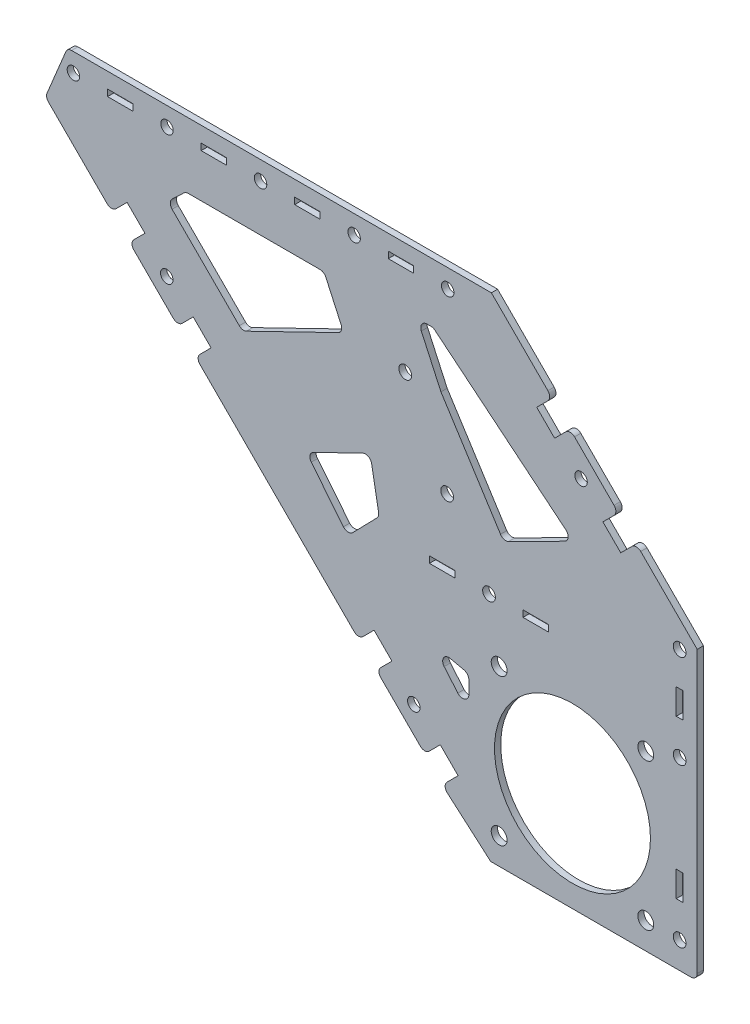
from build123d import *

# Parameters (mm, degrees)
SKETCH_1_R      = 2
SKETCH_1_R_2    = 25
SKETCH_1_R_3    = 2.05
SKETCH_1_R_4    = 2.55
SKETCH_1_W      = 8.1
SKETCH_1_H      = 2.1
SKETCH_1_W_2    = 8.2
SKETCH_1_W_3    = 2.2
SKETCH_1_H_2    = 8.2
EXTRUDE_1_DEPTH = 2
FILLET_2_R      = 2


with BuildPart() as part:
    # 草图1 → 凸台-拉伸1 (new body)
    with BuildSketch(Plane.XY):
        Polygon((7.027428163, -4.999036262), (20.810808237, -16.956988843), (73.227648339, -16.964389058), (87.027428163, -16.964389058), (87.027428163, 75.054738201), (67.497807203, 94.584359161), (63.997628636, 91.084180595), (62.512704395, 89.599256354), (56.785139468, 95.326821282), (58.270063708, 96.811745522), (61.771734574, 100.31043179), (54.027428163, 108.054738201), (46.284614051, 115.797552313), (42.784435485, 112.297373746), (41.299511244, 110.812449505), (35.571946316, 116.540014433), (37.056870557, 118.024938674), (40.557049124, 121.52511724), (21.027428163, 141.054738201), (-114.884210676, 141.054738201), (-121.955278488, 123.983670389), (-100.755816342, 102.784208243), (-97.257364322, 106.282660262), (-95.772440082, 107.767584503), (-90.044875154, 102.040019575), (-91.529799395, 100.555095335), (-95.028251414, 97.056643315), (-87.28543216, 89.313824061), (-79.542612906, 81.571004807), (-76.044160887, 85.069456827), (-74.559236646, 86.554381067), (-68.831671719, 80.82681614), (-70.316595959, 79.341891899), (-73.815047978, 75.84343988), (-21.559856849, 23.58824875), (-18.061404829, 27.086700769), (-16.576480589, 28.57162501), (-10.848915661, 22.844060082), (-12.333839902, 21.359135842), (-15.832291921, 17.860683822), (-8.089472667, 10.117864568), (-0.346653413, 2.375045314), (3.151798606, 5.873497334), (4.636722847, 7.358421574), (10.364287774, 1.630856647), (8.879363534, 0.145932406), (5.380911515, -3.352519613), align=None)
        with Locations((-52.972571837, 135.054738201)):
            Circle(SKETCH_1_R, mode=Mode.SUBTRACT)
        with Locations((47.027428163, 15.054738201)):
            Circle(SKETCH_1_R_2, mode=Mode.SUBTRACT)
        with Locations(Location((-22.972571837, 135.054738201, 0), (0, 0, 180))):
            Circle(SKETCH_1_R, mode=Mode.SUBTRACT)
        with Locations((7.027428163, 135.054738201)):
            Circle(SKETCH_1_R, mode=Mode.SUBTRACT)
        with Locations(Location((-112.972571837, 135.054738201, 0), (0, 0, 180))):
            Circle(SKETCH_1_R, mode=Mode.SUBTRACT)
        with Locations((-82.972571837, 135.054738201)):
            Circle(SKETCH_1_R, mode=Mode.SUBTRACT)
        with Locations((49.784787476, 103.812097514)):
            Circle(SKETCH_1_R, mode=Mode.SUBTRACT)
        with Locations((-83.04451802, 93.554738201)):
            Circle(SKETCH_1_R, mode=Mode.SUBTRACT)
        with Locations((20.275835807, 57.054738201)):
            Circle(SKETCH_1_R_3, mode=Mode.SUBTRACT)
        with Locations((70.527428163, -8.445261799)):
            Circle(SKETCH_1_R_4, mode=Mode.SUBTRACT)
        with Locations((23.527428163, -8.445261799)):
            Circle(SKETCH_1_R_4, mode=Mode.SUBTRACT)
        with Locations((23.527428163, 38.554738201)):
            Circle(SKETCH_1_R_4, mode=Mode.SUBTRACT)
        with Locations((70.527428163, 38.554738201)):
            Circle(SKETCH_1_R_4, mode=Mode.SUBTRACT)
        with Locations((81.392055944, 72.204829046)):
            Circle(SKETCH_1_R_3, mode=Mode.SUBTRACT)
        with Locations((81.392055944, -8.445261799)):
            Circle(SKETCH_1_R_3, mode=Mode.SUBTRACT)
        with Locations((81.392055944, 42.204829046)):
            Circle(SKETCH_1_R_3, mode=Mode.SUBTRACT)
        with Locations((6.845259268, 78.140743367)):
            Circle(SKETCH_1_R_3, mode=Mode.SUBTRACT)
        with Locations(Location((-3.848558527, 14.358778708, 0), (0, 0, 180))):
            Circle(SKETCH_1_R, mode=Mode.SUBTRACT)
        with Locations((-6.58531727, 105.226748532)):
            Circle(SKETCH_1_R_3, mode=Mode.SUBTRACT)
        with Locations((-37.972571837, 135.054738201)):
            Rectangle(SKETCH_1_W, SKETCH_1_H, mode=Mode.SUBTRACT)
        with Locations((-7.972571837, 135.054738201)):
            Rectangle(SKETCH_1_W, SKETCH_1_H, mode=Mode.SUBTRACT)
        with Locations((-97.972571837, 135.054738201)):
            Rectangle(SKETCH_1_W, SKETCH_1_H, mode=Mode.SUBTRACT)
        with Locations((-67.972571837, 135.054738201)):
            Rectangle(SKETCH_1_W, SKETCH_1_H, mode=Mode.SUBTRACT)
        with Locations((5.275835807, 57.054738201)):
            Rectangle(SKETCH_1_W_2, SKETCH_1_H, mode=Mode.SUBTRACT)
        with Locations((35.275835807, 57.054738201)):
            Rectangle(SKETCH_1_W_2, SKETCH_1_H, mode=Mode.SUBTRACT)
        Polygon((-26.317798475, 106.3059132), (-58.783300448, 90.506724064), (-82.786741677, 114.510165293), (-76.96930946, 120.054738201), (-32.606331473, 120.054738201), align=None, mode=Mode.SUBTRACT)
        Polygon((47.299709176, 85.219712632), (24.92619293, 73.952191934), (4.862626833, 105.451990707), (-2.731253041, 122.054738201), (2.37892986, 122.054738201), align=None, mode=Mode.SUBTRACT)
        Polygon((-14.950211349, 60.939664471), (-17.845757969, 77.065019133), (-38.30861977, 67.106860342), (-24.982934729, 50.626518371), align=None, mode=Mode.SUBTRACT)
        Polygon((2.01437662, 34.262984309), (13.802642778, 20.368597473), (13.802642778, 31.594822975), align=None, mode=Mode.SUBTRACT)
        with Locations((81.392055944, 57.204829046)):
            Rectangle(SKETCH_1_W_3, SKETCH_1_H_2, mode=Mode.SUBTRACT)
        with Locations((81.392055944, 6.554738201)):
            Rectangle(SKETCH_1_W_3, SKETCH_1_H_2, mode=Mode.SUBTRACT)
    extrude(amount=EXTRUDE_1_DEPTH)

    # 圆角2
    fillet_2_edges = [part.edges().sort_by_distance(p)[0] for p in [
        (-26.317798475, 106.3059132, 1),
        (-32.606331473, 120.054738201, 1),
        (-76.96930946, 120.054738201, 1),
        (-82.786741677, 114.510165293, 1),
        (-58.783300448, 90.506724064, 1),
        (47.299709176, 85.219712632, 1),
        (2.37892986, 122.054738201, 1),
        (-2.731253041, 122.054738201, 1),
        (24.92619293, 73.952191934, 1),
        (-24.982934729, 50.626518371, 1),
        (-14.950211349, 60.939664471, 1),
        (-17.845757969, 77.065019133, 1),
        (-38.30861977, 67.106860342, 1),
        (13.802642778, 31.594822975, 1),
        (2.01437662, 34.262984309, 1),
        (13.802642778, 20.368597473, 1),
        (40.557049124, 121.52511724, 1),
        (46.284614051, 115.797552313, 1),
        (61.771734574, 100.31043179, 1),
        (67.497807203, 94.584359161, 1),
        (87.027428163, -16.964389058, 1),
        (5.380911515, -3.352519613, 1),
        (-0.346653413, 2.375045314, 1),
        (-15.832291921, 17.860683822, 1),
        (-21.559856849, 23.58824875, 1),
        (-73.815047978, 75.84343988, 1),
        (-79.542612906, 81.571004807, 1),
        (-95.028251414, 97.056643315, 1),
        (-100.755816342, 102.784208243, 1),
        (-121.955278488, 123.983670389, 1),
        (-114.884210676, 141.054738201, 1),
    ]]
    fillet(fillet_2_edges, radius=FILLET_2_R)


solid = part.part
